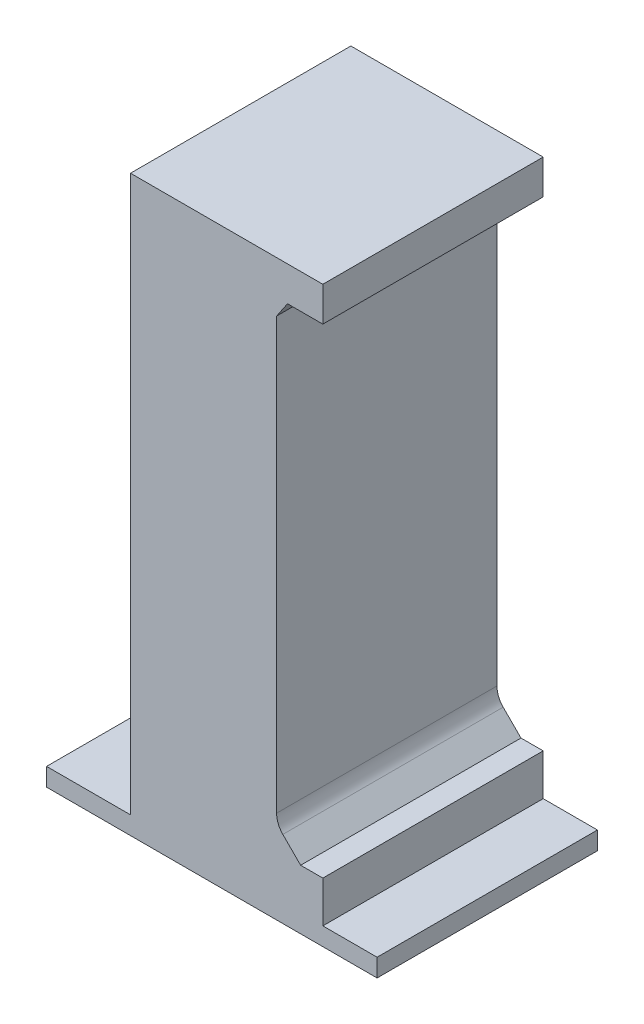
from build123d import *

# Parameters (mm, degrees)
SALIENTE_EXTRUIR3_DEPTH = 500


with BuildPart() as part:
    # Croquis1 → Saliente-Extruir3 (new body)
    with BuildSketch(Plane.XY):
        with BuildLine():
            Line((0, 40.878221652), (0, 0))
            Line((0, 0), (750, 0))
            Line((750, 0), (750, 40.878221652))
            Line((750, 40.878221652), (626.898052252, 40.878221652))
            Line((626.898052252, 40.878221652), (626.898052252, 134.827383306))
            Line((626.898052252, 134.827383306), (576.527963911, 134.827383306))
            Line((576.527963911, 134.827383306), (536.098133641, 175.257213576))
            ThreePointArc((536.098133641, 175.257213576), (525.555715427, 191.210340819), (522.112187733, 210.019566418))
            Line((522.112187733, 210.019566418), (522.112187733, 1186.988416459))
            Line((522.112187733, 1186.988416459), (546.74353007, 1223.418702419))
            Line((546.74353007, 1223.418702419), (626.898052252, 1223.418702419))
            Line((626.898052252, 1223.418702419), (626.898052252, 1301.77405161))
            Line((626.898052252, 1301.77405161), (190.474219634, 1301.77405161))
            Line((190.474219634, 1301.77405161), (190.474219634, 40.878221652))
            Line((190.474219634, 40.878221652), (0, 40.878221652))
        make_face()
    extrude(amount=SALIENTE_EXTRUIR3_DEPTH)


solid = part.part
